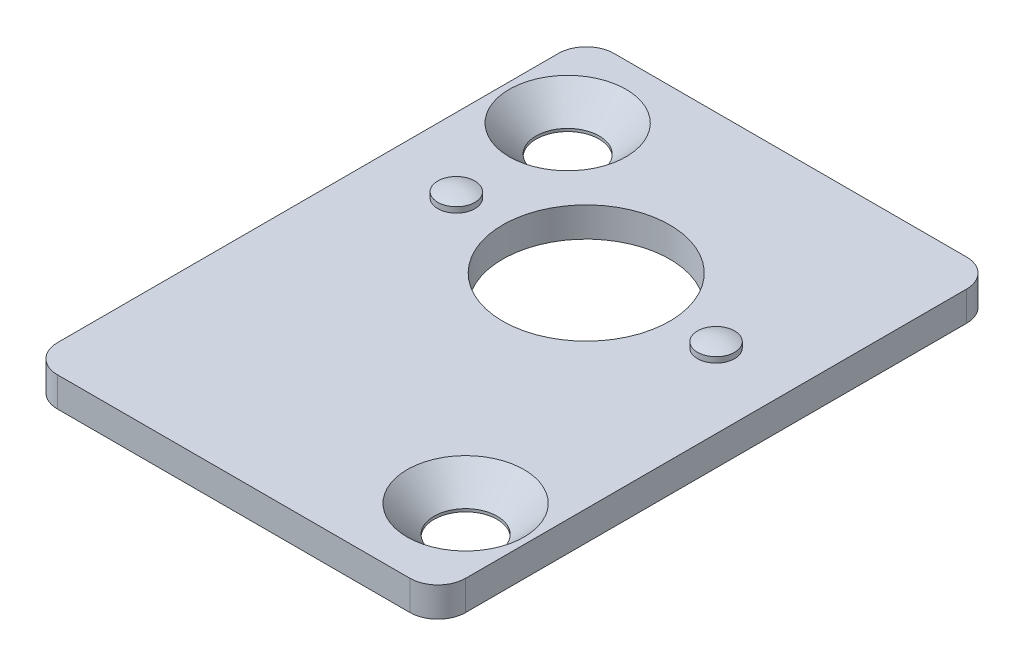
from build123d import *

# Parameters (mm, degrees)
BASES_W                                         = 22
BASES_H                                         = 30
BASE_DEPTH                                      = 1.6
CSK_FOR_M3_FLAT_HEAD_MACHINE_SCREW1_D           = 3.4
CSK_FOR_M3_FLAT_HEAD_MACHINE_SCREW1_DEPTH       = 11
CSK_FOR_M3_FLAT_HEAD_MACHINE_SCREW1_CSINK_D     = 6.3
CSK_FOR_M3_FLAT_HEAD_MACHINE_SCREW1_CSINK_ANGLE = 90
CSK_FOR_M3_FLAT_HEAD_MACHINE_SCREW1_TIP         = 1.021463052
BORES_R                                         = 4.5
BORE_DEPTH                                      = 19.669761648
LOCKINGFEATURES_R                               = 1
LOCKING_FEATURE_DEPTH                           = 0.3
LF_DOME_FACE_RADIUS                             = 1
LF_DOME_HEIGHT                                  = 0.2
LF_HM_COPY_1_FACE_RADIUS                        = 1
LF_HM_COPY_1_HEIGHT                             = 0.2
LFBOTTOMCUT_R                                   = 1
LF_BOTTOM_CUT_DEPTH                             = 0.3
BASE_FILLET_R                                   = 1.5


with BuildPart() as part:
    # BaseS → BASE (new body)
    with BuildSketch(Plane(origin=(0, 0, 0), x_dir=(1, 0, 0), z_dir=(0, 1, 0))):
        Rectangle(BASES_W, BASES_H)
    extrude(amount=-BASE_DEPTH)

    # CSK for M3 Flat Head Machine Screw1
    with Locations(Plane(origin=(0, 0, 0), x_dir=(1, 0, 0), z_dir=(0, 1, 0))):
        with Locations((-7.5, 10.5), (7.5, -10)):
            CounterSinkHole(CSK_FOR_M3_FLAT_HEAD_MACHINE_SCREW1_D / 2, CSK_FOR_M3_FLAT_HEAD_MACHINE_SCREW1_CSINK_D / 2, depth=CSK_FOR_M3_FLAT_HEAD_MACHINE_SCREW1_DEPTH, counter_sink_angle=CSK_FOR_M3_FLAT_HEAD_MACHINE_SCREW1_CSINK_ANGLE)
            with Locations((0, 0, -(CSK_FOR_M3_FLAT_HEAD_MACHINE_SCREW1_DEPTH + CSK_FOR_M3_FLAT_HEAD_MACHINE_SCREW1_TIP / 2))):  # 118° drill point
                Cone(0, CSK_FOR_M3_FLAT_HEAD_MACHINE_SCREW1_D / 2, CSK_FOR_M3_FLAT_HEAD_MACHINE_SCREW1_TIP, mode=Mode.SUBTRACT)

    # BoreS → BORE (cut, through all)
    with BuildSketch(Plane(origin=(0, 0, 0), x_dir=(1, 0, 0), z_dir=(0, 1, 0))):
        with Locations(Location((0, 4, 0), (0, 0, 270))):
            Circle(BORES_R)
    extrude(amount=-BORE_DEPTH, mode=Mode.SUBTRACT)

    # LockingFeatureS → LOCKING FEATURE (add)
    with BuildSketch(Plane(origin=(0, 0, 0), x_dir=(1, 0, 0), z_dir=(0, 1, 0))):
        with Locations(Location((-7, 4, 0), (0, 0, 270))):
            Circle(LOCKINGFEATURES_R)
    locking_feature = extrude(amount=LOCKING_FEATURE_DEPTH)

    # LF DOME: a dome of height H over a round flat face of radius A is a cap of a sphere of radius (A * A + H * H) / (2 * H)
    lf_dome_r = (LF_DOME_FACE_RADIUS * LF_DOME_FACE_RADIUS + LF_DOME_HEIGHT * LF_DOME_HEIGHT) / (2 * LF_DOME_HEIGHT)
    lf_dome_base = Plane((-7, 0.3, -4), z_dir=(0, 1, 0))
    with Locations(lf_dome_base.offset(LF_DOME_HEIGHT - lf_dome_r)):
        lf_dome_ball = Sphere(lf_dome_r, mode=Mode.PRIVATE)
    add(split(lf_dome_ball, bisect_by=lf_dome_base, keep=Keep.TOP, mode=Mode.PRIVATE))

    # LF HM: LOCKING FEATURE across plane
    add(locking_feature.mirror(Plane(origin=(0, 0, 0), x_dir=(0, 0, 1), z_dir=(1, 0, 0))))

    # LF HM copy 1: a dome of height H over a round flat face of radius A is a cap of a sphere of radius (A * A + H * H) / (2 * H)
    lf_hm_copy_1_r = (LF_HM_COPY_1_FACE_RADIUS * LF_HM_COPY_1_FACE_RADIUS + LF_HM_COPY_1_HEIGHT * LF_HM_COPY_1_HEIGHT) / (2 * LF_HM_COPY_1_HEIGHT)
    lf_hm_copy_1_base = Plane((7, 0.3, -4), z_dir=(0, 1, 0))
    with Locations(lf_hm_copy_1_base.offset(LF_HM_COPY_1_HEIGHT - lf_hm_copy_1_r)):
        lf_hm_copy_1_ball = Sphere(lf_hm_copy_1_r, mode=Mode.PRIVATE)
    add(split(lf_hm_copy_1_ball, bisect_by=lf_hm_copy_1_base, keep=Keep.TOP, mode=Mode.PRIVATE))

    # LFBottomCut → LF BOTTOM CUT (cut)
    with BuildSketch(Plane(origin=(0, -1.6, 0), x_dir=(-1, 0, 0), z_dir=(0, -1, 0))):
        with Locations(Location((7, 4, 0), (0, 0, 270))):
            Circle(LFBOTTOMCUT_R)
        with Locations(Location((-7, 4, 0), (0, 0, 270))):
            Circle(LFBOTTOMCUT_R)
    extrude(amount=-LF_BOTTOM_CUT_DEPTH, mode=Mode.SUBTRACT)

    # BASE FILLET
    base_fillet_edges = [part.edges().sort_by_distance(p)[0] for p in [
        (11, -0.8, 15),
        (-11, -0.8, 15),
        (-11, -0.8, -15),
        (11, -0.8, -15),
    ]]
    fillet(base_fillet_edges, radius=BASE_FILLET_R)


solid = part.part
